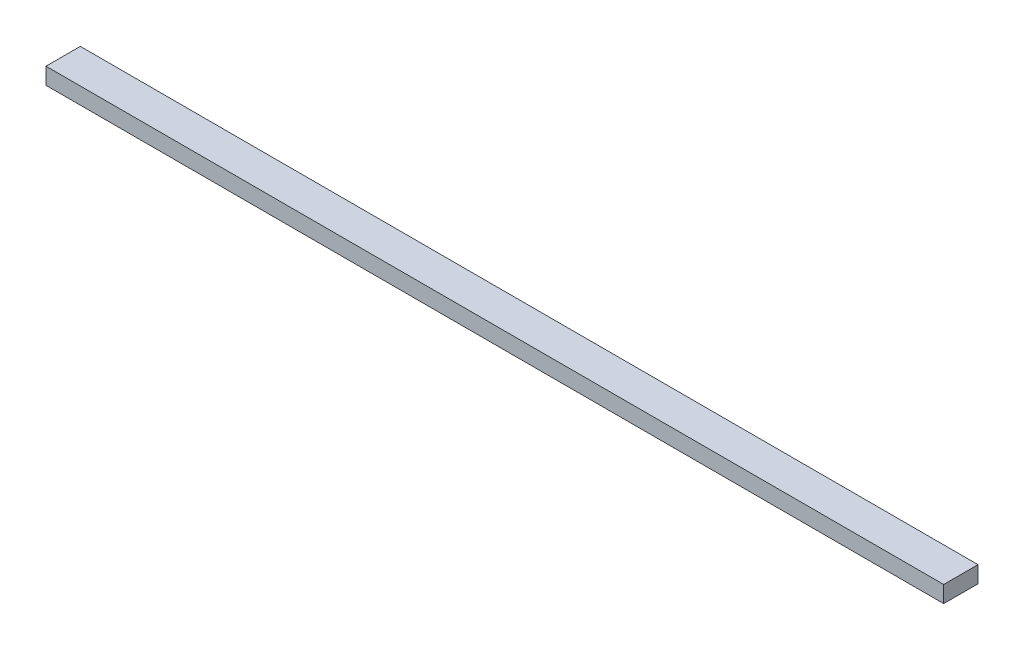
from build123d import *

# Parameters (mm, degrees)
SKETCH1_W           = 5.849060119
SKETCH1_H           = 2.830684137
BOSS_EXTRUDE1_DEPTH = 153


with BuildPart() as part:
    # Sketch1 → Boss-Extrude1 (new body)
    with BuildSketch(Plane(origin=(0, 0, 0), x_dir=(0, 0, -1), z_dir=(1, 0, 0))):
        with Locations((-12.81129446, 89.183238826)):
            Rectangle(SKETCH1_W, SKETCH1_H)
    extrude(amount=BOSS_EXTRUDE1_DEPTH)


solid = part.part
